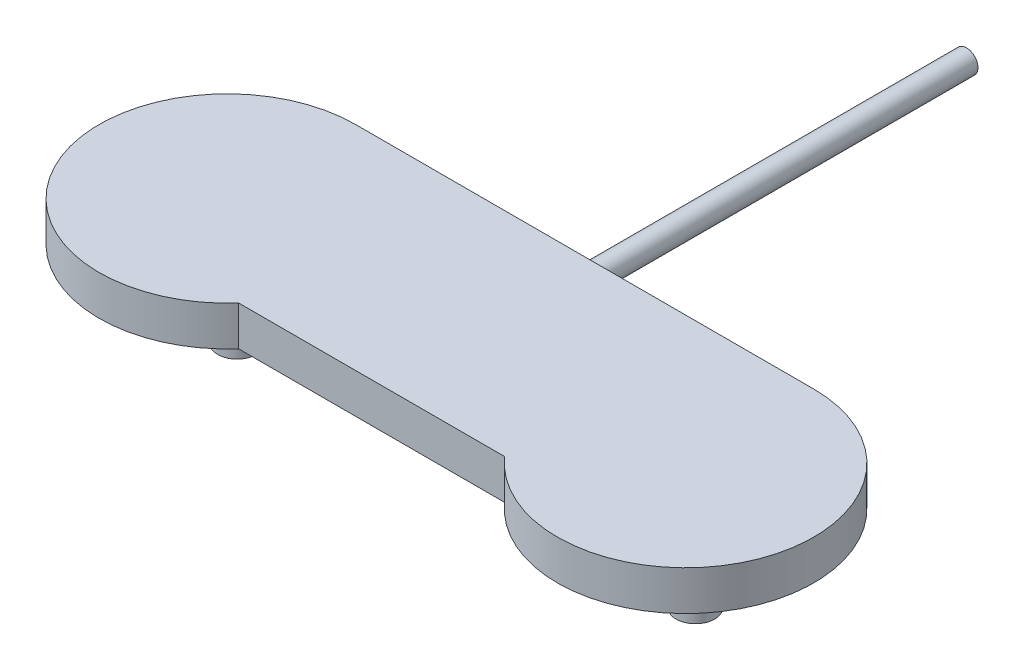
from build123d import *

# Parameters (mm, degrees)
BOSS_EXTRUDE1_DEPTH = 5
SKETCH2_R           = 2.444777137
BOSS_EXTRUDE2_DEPTH = 3
SKETCH4_R           = 1.447783819
BOSS_EXTRUDE3_DEPTH = 48


with BuildPart() as part:
    # Sketch1 → Boss-Extrude1 (new body)
    with BuildSketch(Plane(origin=(0, 0, 0), x_dir=(1, 0, 0), z_dir=(0, 1, 0))):
        with BuildLine():
            Line((0, 16.15299729), (57.736574248, 16.15299729))
            ThreePointArc((57.736574248, 16.15299729), (72.459068519, -6.645862163), (45.621959745, -10.684354773))
            Line((45.621959745, -10.684354773), (12.114614503, -10.684354773))
            ThreePointArc((12.114614503, -10.684354773), (-14.722494271, -6.645862163), (0, 16.15299729))
        make_face()
    extrude(amount=BOSS_EXTRUDE1_DEPTH)

    # Sketch2 → Boss-Extrude2 (add)
    with BuildSketch(Plane(origin=(0, 0, 0), x_dir=(1, 0, 0), z_dir=(0, 1, 0))):
        with Locations(Location((-8.414564217, 7.18153284, 0), (0, 0, 270))):
            Circle(SKETCH2_R)
        with Locations(Location((-8.414564217, -7.18153284, 0), (0, 0, 270))):
            Circle(SKETCH2_R)
        with Locations(Location((8.414564217, 7.18153284, 0), (0, 0, 270))):
            Circle(SKETCH2_R)
        with Locations(Location((8.414564217, -7.18153284, 0), (0, 0, 270))):
            Circle(SKETCH2_R)
        with Locations(Location((66.151138464, 7.18153284, 0), (0, 0, 90))):
            Circle(SKETCH2_R)
        with Locations(Location((66.151138464, -7.18153284, 0), (0, 0, 90))):
            Circle(SKETCH2_R)
        with Locations(Location((49.322010031, -7.18153284, 0), (0, 0, 90))):
            Circle(SKETCH2_R)
        with Locations(Location((49.322010031, 7.18153284, 0), (0, 0, 90))):
            Circle(SKETCH2_R)
    extrude(amount=-BOSS_EXTRUDE2_DEPTH)

    # Sketch4 → Boss-Extrude3 (add)
    with BuildSketch(Plane(origin=(0, 0, -16.15299729), x_dir=(-1, 0, 0), z_dir=(0, 0, -1))):
        with Locations(Location((-28.970152838, 2.400681273, 0), (0, 0, 180))):
            Circle(SKETCH4_R)
    extrude(amount=BOSS_EXTRUDE3_DEPTH)


solid = part.part
